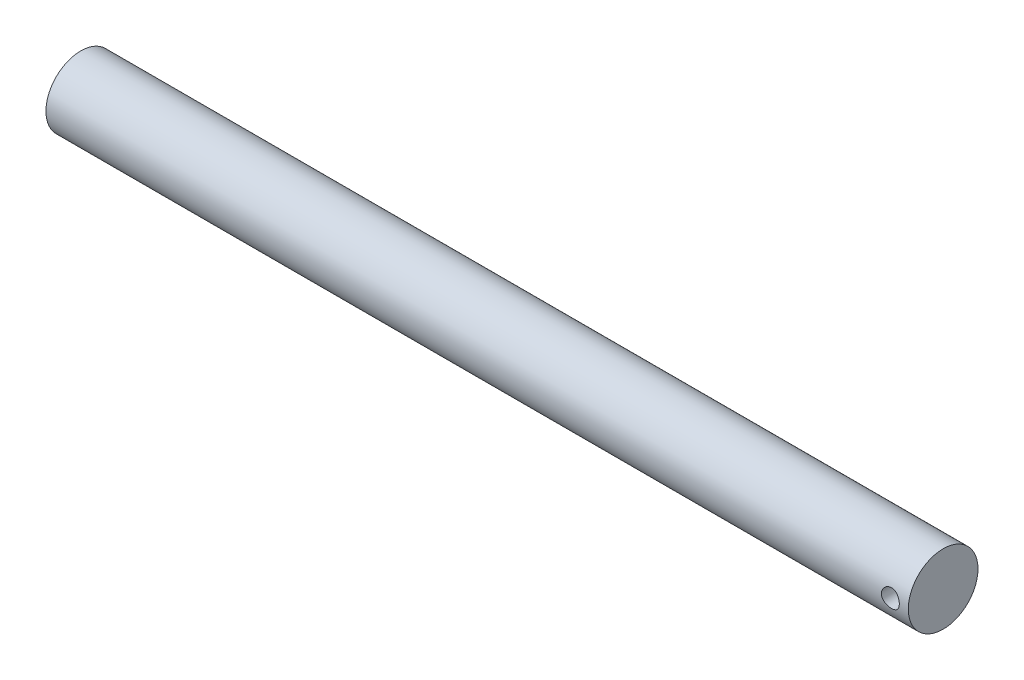
from build123d import *

# Parameters (mm, degrees)
SKETCH1_R               = 4.85
BOSS_EXTRUDE1_DEPTH     = 120
CUT_EXTRUDE1_DEPTH      = 121.195860994
CUT_EXTRUDE1_DEPTH_BACK = 121.195860994
SKETCH2_R               = 1.25
SCALE1_SCALE            = 1.5


with BuildPart() as part:
    # Sketch1 → Boss-Extrude1 (new body)
    with BuildSketch(Plane(origin=(0, 0, 0), x_dir=(0, 0, -1), z_dir=(1, 0, 0))):
        Circle(SKETCH1_R)
    extrude(amount=BOSS_EXTRUDE1_DEPTH)

    # Sketch2 → Cut-Extrude1 (cut, two sides: drawn at the far end of the back side and taken through both)
    with BuildSketch(Plane.XY.offset(-CUT_EXTRUDE1_DEPTH_BACK)):
        with Locations((117.5, 0)):
            Circle(SKETCH2_R)
    extrude(amount=CUT_EXTRUDE1_DEPTH + CUT_EXTRUDE1_DEPTH_BACK, mode=Mode.SUBTRACT)


with BuildPart() as part_1:
    # Scale1: scaled about (59.692221028, 5e-09, 2.22e-07)
    add(part.part.scale(SCALE1_SCALE).moved(Location((-29.846110514, -3e-09, -1.11e-07))))


solid = part_1.part
